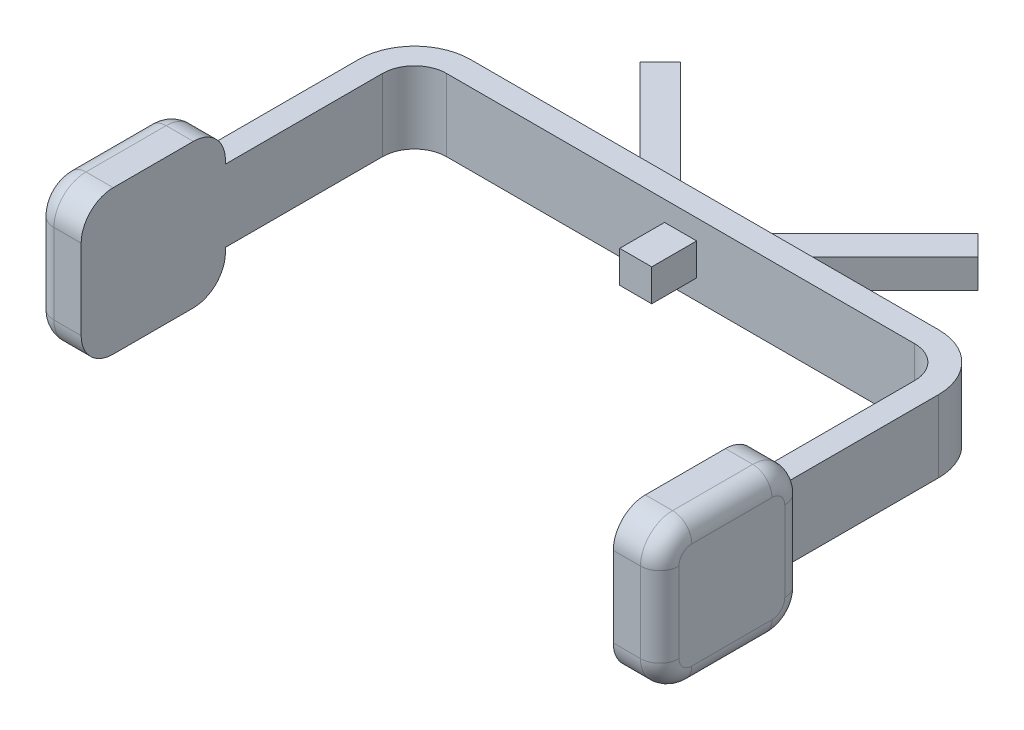
from build123d import *

# Parameters (mm, degrees)
EXTRUDE_2_DEPTH        = 2.25
SKETCH_1_5_W           = 2
SKETCH_1_5_H           = 2.8
EXTRUDE_3_DEPTH        = 1
EXTRUDE_4_DEPTH        = 0.9
EXTRUDE_5_DEPTH        = 2.9
FILLET_1_R             = 1.2
FILLET_1_OF_MIRROR_2_R = 1.2


with BuildPart() as part:
    # 草图1 → 凸台-拉伸2 (new, symmetric)
    with BuildSketch(Plane(origin=(0, 0, 0), x_dir=(1, 0, 0), z_dir=(0, 1, 0))):
        with BuildLine():
            Line((-14.6, -1.5), (14.6, -1.5))
            ThreePointArc((14.6, -1.5), (16.014213562, -2.085786438), (16.6, -3.5))
            Line((16.6, -3.5), (16.6, -13.3))
            Line((16.6, -13.3), (18.1, -13.3))
            Line((18.1, -13.3), (18.1, -3.5))
            ThreePointArc((18.1, -3.5), (17.074873734, -1.025126266), (14.6, 0))
            Line((14.6, 0), (-14.6, 0))
            ThreePointArc((-14.6, 0), (-17.074873734, -1.025126266), (-18.1, -3.5))
            Line((-18.1, -3.5), (-18.1, -13.3))
            Line((-18.1, -13.3), (-16.6, -13.3))
            Line((-16.6, -13.3), (-16.6, -3.5))
            ThreePointArc((-16.6, -3.5), (-16.014213562, -2.085786438), (-14.6, -1.5))
        make_face()
    extrude(amount=EXTRUDE_2_DEPTH, both=True)

    # 草图1<5> → 凸台-拉伸3 (add, symmetric)
    with BuildSketch(Plane(origin=(0, 0, 0), x_dir=(1, 0, 0), z_dir=(0, 1, 0))):
        with Locations((0, -2.9)):
            Rectangle(SKETCH_1_5_W, SKETCH_1_5_H)
    extrude(amount=EXTRUDE_3_DEPTH, both=True)

    # 草图1<6> → 凸台-拉伸4 (add, symmetric)
    with BuildSketch(Plane(origin=(0, 0, 0), x_dir=(1, 0, 0), z_dir=(0, 1, 0))):
        Polygon((-4.045584412, 0), (-1.5, 0), (-9.278174593, 7.778174593), (-10.550966799, 6.505382387), align=None)
        Polygon((9.278174593, 7.778174593), (1.5, 0), (4.045584412, 0), (10.550966799, 6.505382387), align=None)
    extrude(amount=EXTRUDE_4_DEPTH, both=True)

    # 草图2 → 凸台-拉伸5 (add)
    with BuildSketch(Plane.ZY.offset(-16.6)):
        with BuildLine():
            Line((20.3, 4.478921871), (15.3, 4.478921871))
            ThreePointArc((15.3, 4.478921871), (13.885786438, 3.893135433), (13.3, 2.478921871))
            Line((13.3, 2.478921871), (13.3, -2.521078129))
            ThreePointArc((13.3, -2.521078129), (13.885786438, -3.935291691), (15.3, -4.521078129))
            Line((15.3, -4.521078129), (20.3, -4.521078129))
            ThreePointArc((20.3, -4.521078129), (21.714213562, -3.935291691), (22.3, -2.521078129))
            Line((22.3, -2.521078129), (22.3, 2.478921871))
            ThreePointArc((22.3, 2.478921871), (21.714213562, 3.893135433), (20.3, 4.478921871))
        make_face()
    extrude_5 = extrude(amount=-EXTRUDE_5_DEPTH)

    # 圆角1
    fillet_1_edges = [part.edges().sort_by_distance(p)[0] for p in [
        (19.5, -0.021078129, 13.3),
        (19.5, -3.935291691, 13.885786438),
        (19.5, -4.521078129, 17.8),
        (19.5, -3.935291691, 21.714213562),
        (19.5, -0.021078129, 22.3),
        (19.5, 3.893135433, 21.714213562),
        (19.5, 4.478921871, 17.8),
        (19.5, 3.893135433, 13.885786438),
    ]]
    fillet(fillet_1_edges, radius=FILLET_1_R)

    # 镜向2: 凸台-拉伸5 across plane
    add(extrude_5.mirror(Plane(origin=(0, 0, 0), x_dir=(0, 0, 1), z_dir=(1, 0, 0))))

    # 圆角1 of 镜向2
    fillet_1_of_mirror_2_edges = [part.edges().sort_by_distance(p)[0] for p in [
        (-19.5, -0.021078129, 13.3),
        (-19.5, -3.935291691, 13.885786438),
        (-19.5, -4.521078129, 17.8),
        (-19.5, -3.935291691, 21.714213562),
        (-19.5, -0.021078129, 22.3),
        (-19.5, 3.893135433, 21.714213562),
        (-19.5, 4.478921871, 17.8),
        (-19.5, 3.893135433, 13.885786438),
    ]]
    fillet(fillet_1_of_mirror_2_edges, radius=FILLET_1_OF_MIRROR_2_R)


solid = part.part
